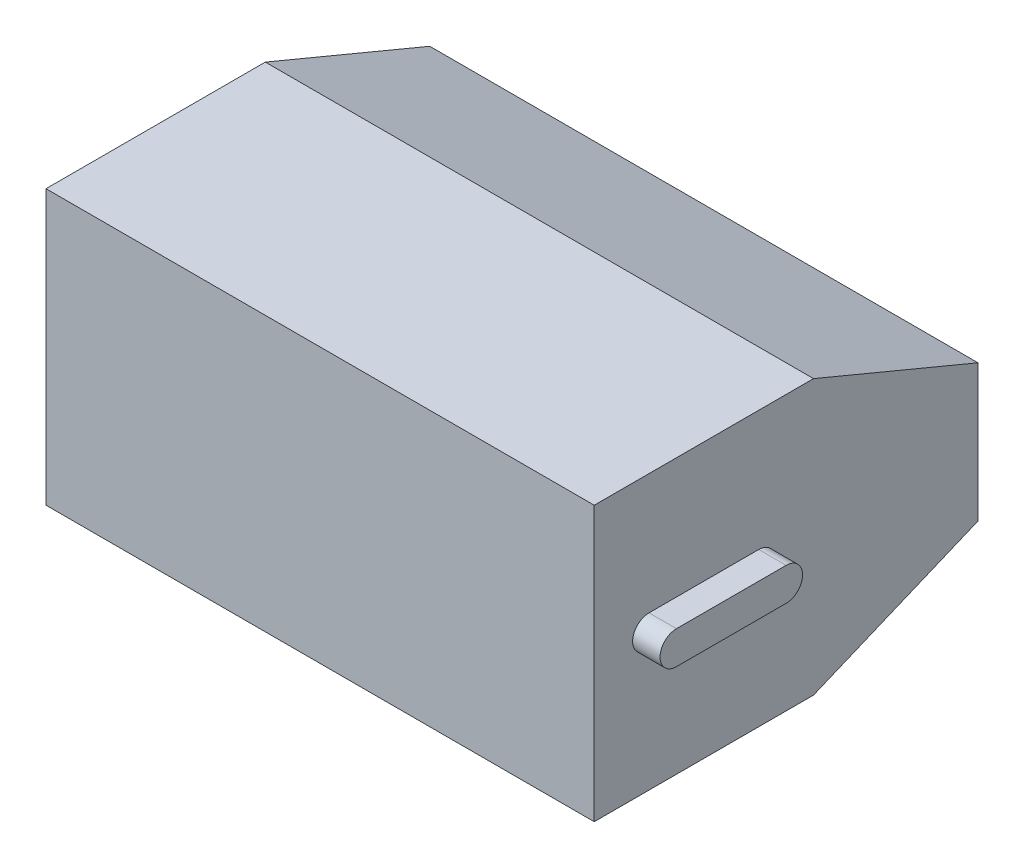
from build123d import *

# Parameters (mm, degrees)
BOSS_EXTRUDE1_DEPTH      = 50
BOSS_EXTRUDE1_DEPTH_BACK = 50
BOSS_EXTRUDE2_START      = 50
BOSS_EXTRUDE2_DEPTH      = 5
BOSS_EXTRUDE3_START      = -55
BOSS_EXTRUDE3_DEPTH      = 5


with BuildPart() as part:
    # Sketch2 → Boss-Extrude1 (new, two sides: drawn at the far end of the back side and taken through both)
    with BuildSketch(Plane(origin=(0, 0, 0), x_dir=(0, 0, -1), z_dir=(1, 0, 0)).offset(-BOSS_EXTRUDE1_DEPTH_BACK)):
        Polygon((-147.070290747, 193.522440667), (-147.070290747, 218.522440667), (-177.070290747, 231.022440667), (-217.070290747, 231.022440667), (-217.070290747, 181.022440667), (-177.070290747, 181.022440667), align=None)
    extrude(amount=BOSS_EXTRUDE1_DEPTH + BOSS_EXTRUDE1_DEPTH_BACK)

    # Sketch3 → Boss-Extrude2 (add)
    with BuildSketch(Plane(origin=(0, 0, 0), x_dir=(0, 0, -1), z_dir=(1, 0, 0)).offset(BOSS_EXTRUDE2_START)):
        with BuildLine():
            Line((-207.070290747, 203.022440667), (-187.070290747, 203.022440667))
            ThreePointArc((-187.070290747, 203.022440667), (-184.070290747, 206.022440667), (-187.070290747, 209.022440667))
            Line((-187.070290747, 209.022440667), (-207.070290747, 209.022440667))
            ThreePointArc((-207.070290747, 209.022440667), (-210.070290747, 206.022440667), (-207.070290747, 203.022440667))
        make_face()
    extrude(amount=BOSS_EXTRUDE2_DEPTH)

    # Sketch3<2> → Boss-Extrude3 (add)
    with BuildSketch(Plane(origin=(0, 0, 0), x_dir=(0, 0, -1), z_dir=(1, 0, 0)).offset(BOSS_EXTRUDE3_START)):
        with BuildLine():
            Line((-207.070290747, 203.022440667), (-187.070290747, 203.022440667))
            ThreePointArc((-187.070290747, 203.022440667), (-184.070290747, 206.022440667), (-187.070290747, 209.022440667))
            Line((-187.070290747, 209.022440667), (-207.070290747, 209.022440667))
            ThreePointArc((-207.070290747, 209.022440667), (-210.070290747, 206.022440667), (-207.070290747, 203.022440667))
        make_face()
    extrude(amount=BOSS_EXTRUDE3_DEPTH)


solid = part.part
